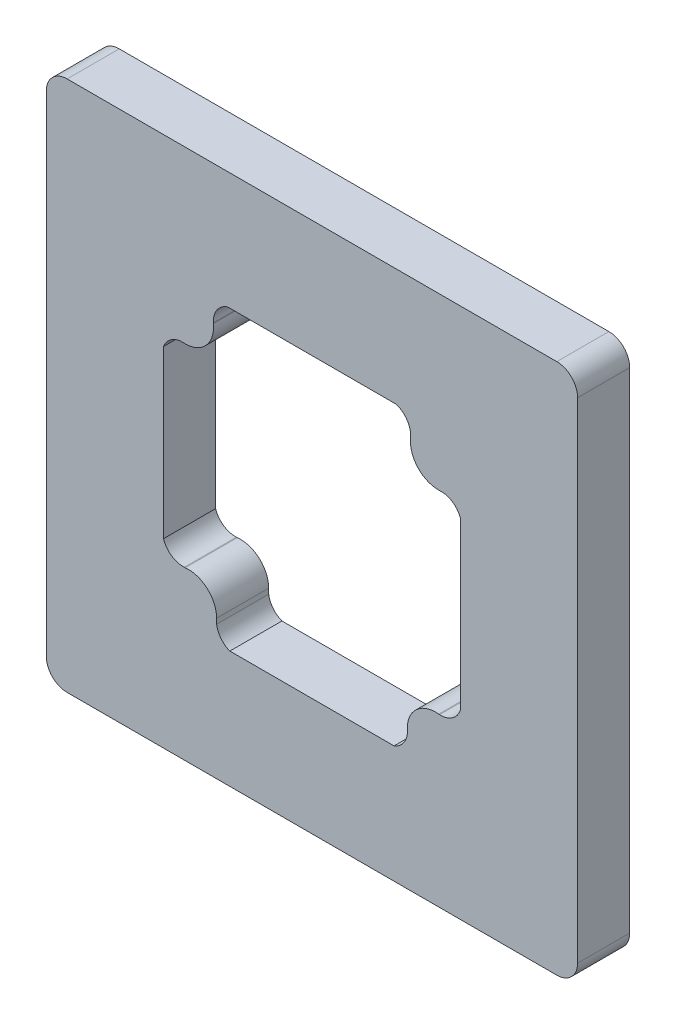
from build123d import *

# Parameters (mm, degrees)
BOSS_EXTRUDE1_DEPTH = 5


with BuildPart() as part:
    # Sketch1 → Boss-Extrude1 (new, symmetric)
    with BuildSketch(Plane.XY):
        with BuildLine():
            Line((-47, 51), (47, 51))
            ThreePointArc((47, 51), (49.828427125, 49.828427125), (51, 47))
            Line((51, 47), (51, -47))
            ThreePointArc((51, -47), (49.828427125, -49.828427125), (47, -51))
            Line((47, -51), (-47, -51))
            ThreePointArc((-47, -51), (-49.828427125, -49.828427125), (-51, -47))
            Line((-51, -47), (-51, 47))
            ThreePointArc((-51, 47), (-49.828427125, 49.828427125), (-47, 51))
        make_face()
        with BuildLine():
            Line((-18.935786438, 24.335135157), (-18.935786438, 24.5))
            ThreePointArc((-18.935786438, 24.5), (-18.239751149, 26.963133018), (-16.192917188, 28.5))
            Line((-16.192917188, 28.5), (16.192917188, 28.5))
            ThreePointArc((16.192917188, 28.5), (18.239751149, 26.963133018), (18.935786438, 24.5))
            Line((18.935786438, 24.5), (18.935786438, 24.335135157))
            ThreePointArc((18.935786438, 24.335135157), (20.272310951, 20.112043563), (24.314285714, 18.300072152))
            Line((24.314285714, 18.300072152), (25.314285714, 18.300072152))
            ThreePointArc((25.314285714, 18.300072152), (27.253927817, 17.467886008), (28.5, 15.76434576))
            Line((28.5, 15.76434576), (28.5, -16.192917188))
            ThreePointArc((28.5, -16.192917188), (26.963133018, -18.239751149), (24.5, -18.935786438))
            Line((24.5, -18.935786438), (24.335135157, -18.935786438))
            ThreePointArc((24.335135157, -18.935786438), (20.112043563, -20.272310951), (18.300072152, -24.314285714))
            Line((18.300072152, -24.314285714), (18.300072152, -25.314285714))
            ThreePointArc((18.300072152, -25.314285714), (17.467886008, -27.253927817), (15.76434576, -28.5))
            Line((15.76434576, -28.5), (-15.76434576, -28.5))
            ThreePointArc((-15.76434576, -28.5), (-17.467886008, -27.253927817), (-18.300072152, -25.314285714))
            Line((-18.300072152, -25.314285714), (-18.300072152, -24.314285714))
            ThreePointArc((-18.300072152, -24.314285714), (-20.112043563, -20.272310951), (-24.335135157, -18.935786438))
            Line((-24.335135157, -18.935786438), (-24.5, -18.935786438))
            ThreePointArc((-24.5, -18.935786438), (-26.963133018, -18.239751149), (-28.5, -16.192917188))
            Line((-28.5, -16.192917188), (-28.5, 15.76434576))
            ThreePointArc((-28.5, 15.76434576), (-27.253927817, 17.467886008), (-25.314285714, 18.300072152))
            Line((-25.314285714, 18.300072152), (-24.314285714, 18.300072152))
            ThreePointArc((-24.314285714, 18.300072152), (-20.272310951, 20.112043563), (-18.935786438, 24.335135157))
        make_face(mode=Mode.SUBTRACT)
    extrude(amount=BOSS_EXTRUDE1_DEPTH, both=True)


solid = part.part
